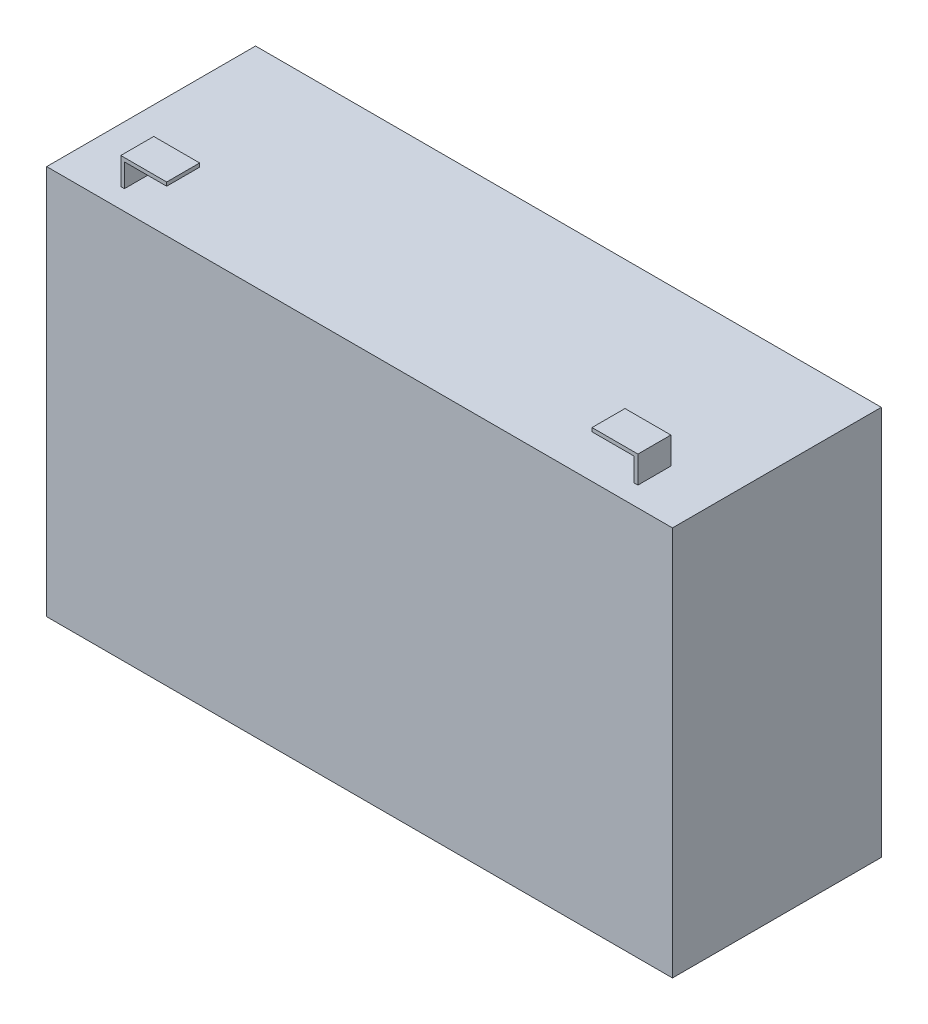
from build123d import *

# Parameters (mm, degrees)
SKETCH2_W      = 150.6728
SKETCH2_H      = 93.853
EXTRUDE1_DEPTH = 50.292
SKETCH3_W      = 0.889
SKETCH3_H      = 7.9375
EXTRUDE2_DEPTH = 6.477
SKETCH5_W      = 11.049
SKETCH5_H      = 7.9375
EXTRUDE3_DEPTH = 0.889


with BuildPart() as part:
    # Sketch2 → Extrude1 (new body)
    with BuildSketch(Plane.XY):
        with Locations((75.3364, 46.9265)):
            Rectangle(SKETCH2_W, SKETCH2_H)
    extrude(amount=EXTRUDE1_DEPTH)

    # Sketch3 → Extrude2 (add)
    with BuildSketch(Plane(origin=(0, 93.853, 0), x_dir=(-1, 0, 0), z_dir=(0, 1, 0))):
        with Locations((-13.5255, 41.56075)):
            Rectangle(SKETCH3_W, SKETCH3_H)
        with Locations((-137.1473, 41.56075)):
            Rectangle(SKETCH3_W, SKETCH3_H)
    extrude(amount=EXTRUDE2_DEPTH)

    # Sketch5 → Extrude3 (add)
    with BuildSketch(Plane(origin=(0, 100.33, 0), x_dir=(-1, 0, 0), z_dir=(0, 1, 0))):
        with Locations((-18.6055, 41.56075)):
            Rectangle(SKETCH5_W, SKETCH5_H)
        with Locations((-132.0673, 41.56075)):
            Rectangle(SKETCH5_W, SKETCH5_H)
    extrude(amount=-EXTRUDE3_DEPTH)


solid = part.part
